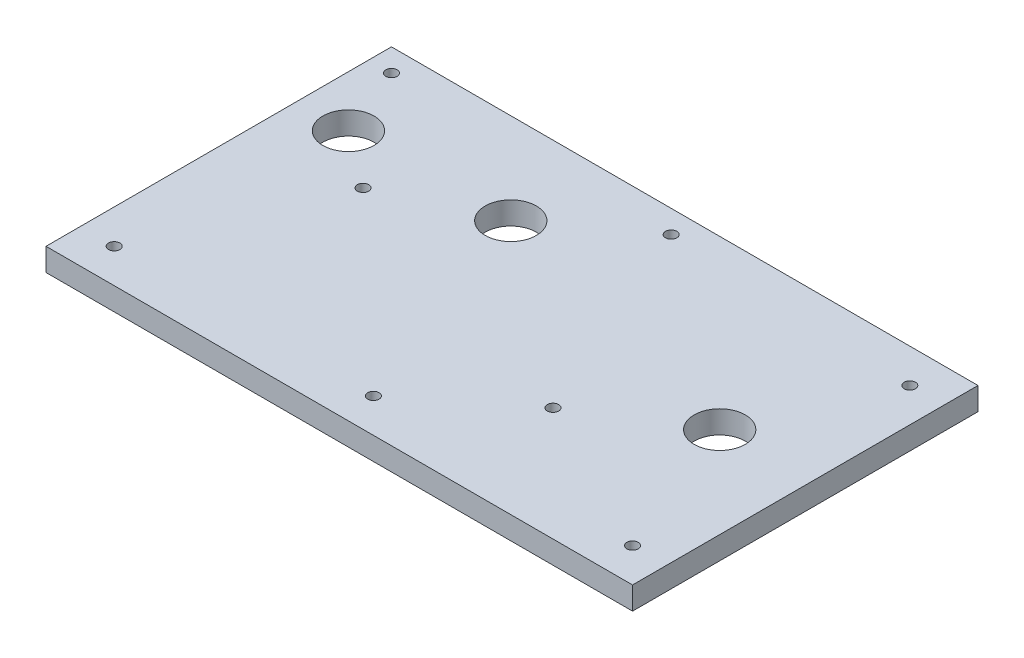
from build123d import *

# Parameters (mm, degrees)
SKETCH1_W           = 327.74935392
SKETCH1_H           = 193.04
SKETCH1_R           = 14.2875
SKETCH1_R_2         = 3.175
BOSS_EXTRUDE1_DEPTH = 12.7


with BuildPart() as part:
    # Sketch1 → Boss-Extrude1 (new body)
    with BuildSketch(Plane(origin=(0, 0, 0), x_dir=(1, 0, 0), z_dir=(0, 1, 0))):
        with Locations((46.39967696, -45.72)):
            Rectangle(SKETCH1_W, SKETCH1_H)
        with Locations(Location((0, 0, 0), (0, 0, 270))):
            Circle(SKETCH1_R, mode=Mode.SUBTRACT)
        with Locations(Location((159.47435392, -42.731024346, 0), (0, 0, 270))):
            Circle(SKETCH1_R, mode=Mode.SUBTRACT)
        with Locations(Location((-88.9, -1.817931401, 0), (0, 0, 270))):
            Circle(SKETCH1_R, mode=Mode.SUBTRACT)
        with Locations(Location((-98.425, -123.19, 0), (0, 0, 270))):
            Circle(SKETCH1_R_2, mode=Mode.SUBTRACT)
        with Locations(Location((191.22435392, -123.19, 0), (0, 0, 270))):
            Circle(SKETCH1_R_2, mode=Mode.SUBTRACT)
        with Locations(Location((191.22435392, 31.75, 0), (0, 0, 270))):
            Circle(SKETCH1_R_2, mode=Mode.SUBTRACT)
        with Locations(Location((102.32435392, -78.74, 0), (0, 0, 270))):
            Circle(SKETCH1_R_2, mode=Mode.SUBTRACT)
        with Locations(Location((46.3996786, -123.19, 0), (0, 0, 270))):
            Circle(SKETCH1_R_2, mode=Mode.SUBTRACT)
        with Locations(Location((-57.15, -25.4, 0), (0, 0, 270))):
            Circle(SKETCH1_R_2, mode=Mode.SUBTRACT)
        with Locations(Location((-104.775, 38.1, 0), (0, 0, 270))):
            Circle(SKETCH1_R_2, mode=Mode.SUBTRACT)
        with Locations(Location((51.52435392, 38.1, 0), (0, 0, 270))):
            Circle(SKETCH1_R_2, mode=Mode.SUBTRACT)
    extrude(amount=BOSS_EXTRUDE1_DEPTH)


solid = part.part
